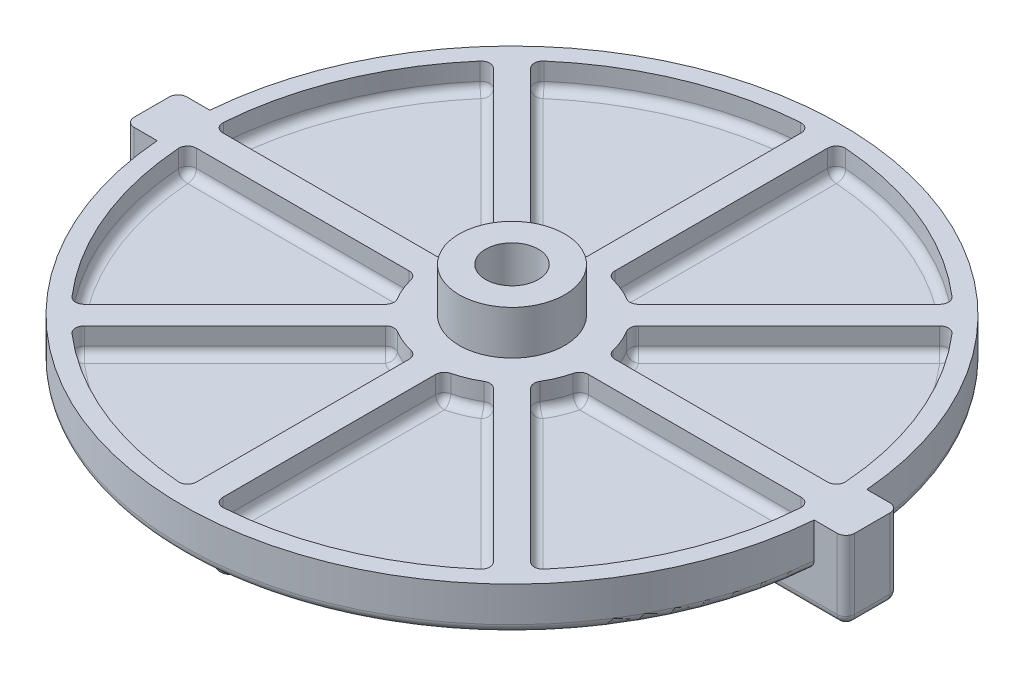
from build123d import *

# Parameters (mm, degrees)
SKETCH1_R                    = 37.5
BOSS_EXTRUDE1_DEPTH          = 5
SHELL1_T                     = -2
SKETCH2_R                    = 9.5
BOSS_EXTRUDE2_DEPTH          = 3
SKETCH3_R                    = 6
BOSS_EXTRUDE3_DEPTH          = 5
RIB1_REACH                   = 55.268
SKETCH4_WALLS_W              = 144.036378764
SKETCH4_WALLS_H              = 3
CIRPATTERN1_COUNT            = 8
BOSS_EXTRUDE4_DEPTH          = 4
SKETCH6_W                    = 82
SKETCH6_H                    = 6
BOSS_EXTRUDE5_DEPTH          = 4
BOSS_EXTRUDE6_DEPTH          = 5
BOSS_EXTRUDE7_DEPTH          = 5
F_6_0_6_DIAMETER_HOLE1_D     = 6
F_6_0_6_DIAMETER_HOLE1_DEPTH = 8
F_6_0_6_DIAMETER_HOLE1_TIP   = 1.802581857
FILLET3_R                    = 1
FILLET4_R                    = 1
FILLET5_R                    = 1
FILLET6_R                    = 1


with BuildPart() as part:
    # Sketch1 → Boss-Extrude1 (new body)
    with BuildSketch(Plane(origin=(0, 0, 0), x_dir=(1, 0, 0), z_dir=(0, 1, 0))):
        with Locations(Location((0, 0, 0), (0, 0, 270))):
            Circle(SKETCH1_R)
    extrude(amount=BOSS_EXTRUDE1_DEPTH)

    # Shell1
    shell1_openings = [part.faces().sort_by_distance(p)[0] for p in [
        (0, 5, 0),
    ]]
    offset(amount=SHELL1_T, openings=shell1_openings, kind=Kind.INTERSECTION)

    # Sketch2 → Boss-Extrude2 (add)
    with BuildSketch(Plane(origin=(0, 2, 0), x_dir=(1, 0, 0), z_dir=(0, 1, 0))):
        with Locations(Location((0, 0, 0), (0, 0, 270))):
            Circle(SKETCH2_R)
    extrude(amount=BOSS_EXTRUDE2_DEPTH)

    # Sketch3 → Boss-Extrude3 (add)
    with BuildSketch(Plane(origin=(0, 5, 0), x_dir=(1, 0, 0), z_dir=(0, 1, 0))):
        with Locations(Location((0, 0, 0), (0, 0, 270))):
            Circle(SKETCH3_R)
    extrude(amount=BOSS_EXTRUDE3_DEPTH)

    # Sketch4 walls → Rib1 (add, up to next)
    with BuildSketch(Plane(origin=(0, 5, 0), x_dir=(1, 0, 0), z_dir=(0, 1, 0)), mode=Mode.PRIVATE) as rib1_sk1:
        with Locations((17.75, 0)):
            Rectangle(SKETCH4_WALLS_W, SKETCH4_WALLS_H)
    rib1_tool1 = extrude(rib1_sk1.sketch, amount=-RIB1_REACH, mode=Mode.PRIVATE) - part.part
    rib1 = rib1_tool1.solids().sort_by_distance((17.75, 5, 0))[0]
    add(rib1)

    # CirPattern1: Rib1 ×8 about axis
    cirpattern1_axis = Axis((0, 0, 0), (0, 1, 0))
    for i in range(1, CIRPATTERN1_COUNT):
        add(rib1.rotate(cirpattern1_axis, i * 360 / CIRPATTERN1_COUNT))

    # Sketch5 → Boss-Extrude4 (add)
    with BuildSketch(Plane.XZ):
        with BuildLine():
            Line((1.5, -17), (1.5, -32))
            ThreePointArc((1.5, -32), (0, -33.5), (-1.5, -32))
            Line((-1.5, -32), (-1.5, -17))
            ThreePointArc((-1.5, -17), (0, -15.5), (1.5, -17))
        make_face()
    boss_extrude4 = extrude(amount=BOSS_EXTRUDE4_DEPTH)

    # Mirror1: Boss-Extrude4 across plane
    add(boss_extrude4.mirror(Plane.XY))

    # Sketch6 → Boss-Extrude5 (add)
    with BuildSketch(Plane.XZ):
        Rectangle(SKETCH6_W, SKETCH6_H)
    extrude(amount=BOSS_EXTRUDE5_DEPTH)

    # Sketch7 → Boss-Extrude6 (add)
    with BuildSketch(Plane(origin=(0, 0, 0), x_dir=(1, 0, 0), z_dir=(0, 1, 0))):
        with BuildLine():
            Line((41, 3), (37.379807383, 3))
            ThreePointArc((37.379807383, 3), (37.5, 0), (37.379807383, -3))
            Line((37.379807383, -3), (41, -3))
            Line((41, -3), (41, 3))
        make_face()
    extrude(amount=BOSS_EXTRUDE6_DEPTH)

    # Sketch8 → Boss-Extrude7 (add)
    with BuildSketch(Plane(origin=(0, 0, 0), x_dir=(1, 0, 0), z_dir=(0, 1, 0))):
        with BuildLine():
            Line((-41, -3), (-37.379807383, -3))
            ThreePointArc((-37.379807383, -3), (-37.5, 0), (-37.379807383, 3))
            Line((-37.379807383, 3), (-41, 3))
            Line((-41, 3), (-41, -3))
        make_face()
    extrude(amount=BOSS_EXTRUDE7_DEPTH)

    # Ø6.0 (6) Diameter Hole1
    with Locations(Plane(origin=(0, 10, 0), x_dir=(1, 0, 0), z_dir=(0, 1, 0))):
        with Locations((0, 0)):
            Hole(F_6_0_6_DIAMETER_HOLE1_D / 2, depth=F_6_0_6_DIAMETER_HOLE1_DEPTH)
            with Locations((0, 0, -(F_6_0_6_DIAMETER_HOLE1_DEPTH + F_6_0_6_DIAMETER_HOLE1_TIP / 2))):  # 118° drill point
                Cone(0, F_6_0_6_DIAMETER_HOLE1_D / 2, F_6_0_6_DIAMETER_HOLE1_TIP, mode=Mode.SUBTRACT)

    # Fillet3
    fillet3_edges = [part.edges().sort_by_distance(p)[0] for p in [
        (5.572589409, 3.5, 7.693909752),
        (7.693909752, 3.5, 5.572589409),
        (24.019212236, 3.5, 26.14053258),
        (26.14053258, 3.5, 24.019212236),
        (9.38083152, 3.5, 1.5),
        (1.5, 3.5, 9.38083152),
        (-1.5, 3.5, 35.468295702),
        (9.38083152, 3.5, -1.5),
        (1.5, 3.5, 35.468295702),
        (-1.5, 3.5, 9.38083152),
        (-5.572589409, 3.5, 7.693909752),
        (-26.14053258, 3.5, 24.019212236),
        (-24.019212236, 3.5, 26.14053258),
        (-7.693909752, 3.5, 5.572589409),
        (-9.38083152, 3.5, 1.5),
        (-35.468295702, 3.5, -1.5),
        (-35.468295702, 3.5, 1.5),
        (-9.38083152, 3.5, -1.5),
        (-7.693909752, 3.5, -5.572589409),
        (-24.019212236, 3.5, -26.14053258),
        (-26.14053258, 3.5, -24.019212236),
        (-5.572589409, 3.5, -7.693909752),
        (35.468295702, 3.5, 1.5),
        (-1.5, 3.5, -9.38083152),
        (1.5, 3.5, -35.468295702),
        (-1.5, 3.5, -35.468295702),
        (1.5, 3.5, -9.38083152),
        (35.468295702, 3.5, -1.5),
        (5.572589409, 3.5, -7.693909752),
        (26.14053258, 3.5, -24.019212236),
        (24.019212236, 3.5, -26.14053258),
        (7.693909752, 3.5, -5.572589409),
    ]]
    fillet(fillet3_edges, radius=FILLET3_R)

    # Fillet4
    fillet4_edges = [part.edges().sort_by_distance(p)[0] for p in [
        (-16.831736508, 2, -14.710416164),
        (-32.797723404, 2, -13.585261849),
        (-22.303670048, 2, -1.5),
        (-8.776855559, 2, -3.635492607),
        (-7.986085083, 2, -5.563248458),
        (-9.580825627, 2, -1.713204208),
        (-35.141579624, 2, -1.818994775),
        (-26.135072795, 2, -23.562625713),
        (-1.5, 2, -22.303670048),
        (-13.585261849, 2, -32.797723404),
        (-14.710416164, 2, -16.831736508),
        (-3.635492607, 2, -8.776855559),
        (-1.713204208, 2, -9.580825627),
        (-5.563248458, 2, -7.986085083),
        (-23.562625713, 2, -26.135072795),
        (-1.818994775, 2, -35.141579624),
        (32.797723404, 2, 13.585261849),
        (16.831736508, 2, 14.710416164),
        (22.303670048, 2, 1.5),
        (8.776855559, 2, 3.635492607),
        (26.135072795, 2, 23.562625713),
        (7.986085083, 2, 5.563248458),
        (9.580825627, 2, 1.713204208),
        (35.141579624, 2, 1.818994775),
        (13.585261849, 2, 32.797723404),
        (1.5, 2, 22.303670048),
        (14.710416164, 2, 16.831736508),
        (3.635492607, 2, 8.776855559),
        (1.818994775, 2, 35.141579624),
        (1.713204208, 2, 9.580825627),
        (5.563248458, 2, 7.986085083),
        (23.562625713, 2, 26.135072795),
        (-13.585261849, 2, 32.797723404),
        (-14.710416164, 2, 16.831736508),
        (-1.5, 2, 22.303670048),
        (-3.635492607, 2, 8.776855559),
        (-23.562625713, 2, 26.135072795),
        (-5.563248458, 2, 7.986085083),
        (-1.713204208, 2, 9.580825627),
        (-1.818994775, 2, 35.141579624),
        (22.303670048, 2, -1.5),
        (32.797723404, 2, -13.585261849),
        (16.831736508, 2, -14.710416164),
        (8.776855559, 2, -3.635492607),
        (9.580825627, 2, -1.713204208),
        (7.986085083, 2, -5.563248458),
        (26.135072795, 2, -23.562625713),
        (35.141579624, 2, -1.818994775),
        (-16.831736508, 2, 14.710416164),
        (-22.303670048, 2, 1.5),
        (-32.797723404, 2, 13.585261849),
        (-8.776855559, 2, 3.635492607),
        (-26.135072795, 2, 23.562625713),
        (-35.141579624, 2, 1.818994775),
        (-9.580825627, 2, 1.713204208),
        (-7.986085083, 2, 5.563248458),
        (14.710416164, 2, -16.831736508),
        (13.585261849, 2, -32.797723404),
        (1.5, 2, -22.303670048),
        (3.635492607, 2, -8.776855559),
        (5.563248458, 2, -7.986085083),
        (1.713204208, 2, -9.580825627),
        (1.818994775, 2, -35.141579624),
        (23.562625713, 2, -26.135072795),
    ]]
    fillet(fillet4_edges, radius=FILLET4_R)

    # Fillet5
    fillet5_edges = [part.edges().sort_by_distance(p)[0] for p in [
        (-41, -4, 0),
        (41, -4, 0),
    ]]
    fillet(fillet5_edges, radius=FILLET5_R)

    # Fillet6
    fillet6_edges = [part.edges().sort_by_distance(p)[0] for p in [
        (0, -4, 3),
        (0, -4, -3),
        (41, 1, 3),
        (-41, 1, 3),
        (-40.707106781, -3.707106781, 3),
        (40.707106781, -3.707106781, 3),
        (41, 1, -3),
        (-41, 1, -3),
        (-40.707106781, -3.707106781, -3),
        (40.707106781, -3.707106781, -3),
        (0, 0, -15.5),
        (-1.5, 0, -24.5),
        (0, 0, -33.5),
        (1.5, 0, -24.5),
        (0, -4, -15.5),
        (-1.5, -4, -24.5),
        (0, -4, -33.5),
        (1.5, -4, -24.5),
        (0, -4, 15.5),
        (1.5, -4, 24.5),
        (0, -4, 33.5),
        (-1.5, -4, 24.5),
        (0, 0, 15.5),
        (-1.5, 0, 24.5),
        (0, 0, 33.5),
        (1.5, 0, 24.5),
        (0, 0, -37.5),
        (0, 0, 37.5),
    ]]
    fillet(fillet6_edges, radius=FILLET6_R)


solid = part.part
